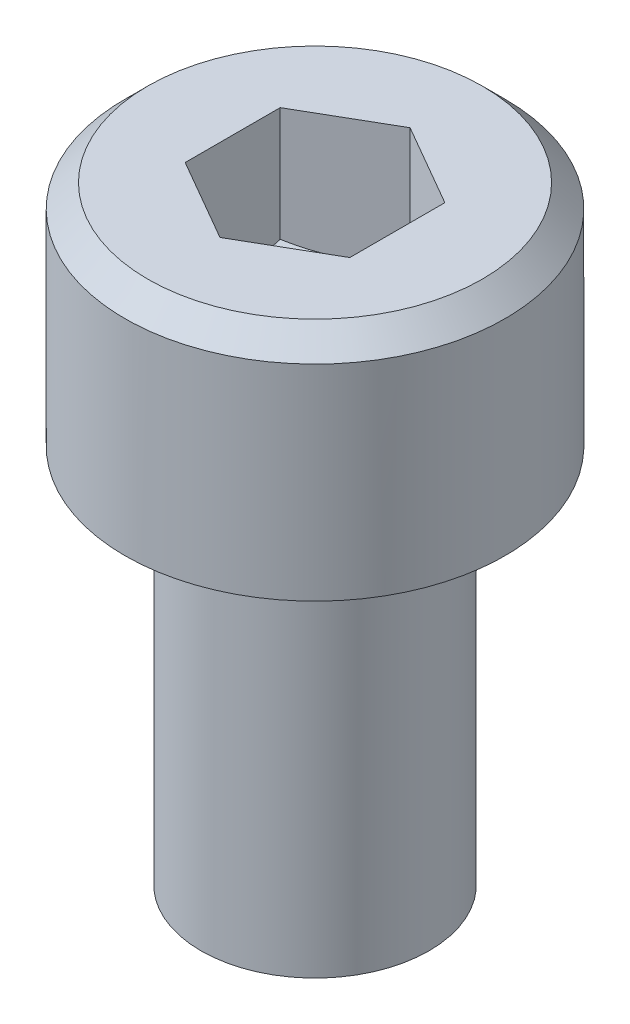
from build123d import *

# Parameters (mm, degrees)
CROQUIS4_R              = 5
SALIENTE_EXTRUIR3_DEPTH = 6
CHAFL_N2_SIZE           = 0.6
CROQUIS6_5_R            = 3
SALIENTE_EXTRUIR7_DEPTH = 10


with BuildPart() as part:
    # Croquis4 → Saliente-Extruir3 (new body)
    with BuildSketch(Plane(origin=(0, 0, 0), x_dir=(1, 0, 0), z_dir=(0, 1, 0))):
        Circle(CROQUIS4_R)
        Polygon((0, 2.5), (-2.165063509, 1.25), (-2.165063509, -1.25), (0, -2.5), (2.165063509, -1.25), (2.165063509, 1.25), align=None, mode=Mode.SUBTRACT)
    extrude(amount=SALIENTE_EXTRUIR3_DEPTH)

    # Chaflán2
    chafl_n2_edges = [part.edges().sort_by_distance(p)[0] for p in [
        (-5, 6, 0),
    ]]
    chamfer(chafl_n2_edges, length=CHAFL_N2_SIZE)

    # Croquis5 → Revolución2 (revolve)
    with BuildSketch(Plane.XY):
        Polygon((0, 0), (0, 1.556624327), (2.5, 3), (5, 3), (5, 0), align=None)
    revolve(axis=Axis((0, 0, 0), (0, 1, 0)))

    # Croquis6<5> → Saliente-Extruir7 (add)
    with BuildSketch(Plane.XZ):
        Circle(CROQUIS6_5_R)
    extrude(amount=SALIENTE_EXTRUIR7_DEPTH)


solid = part.part
